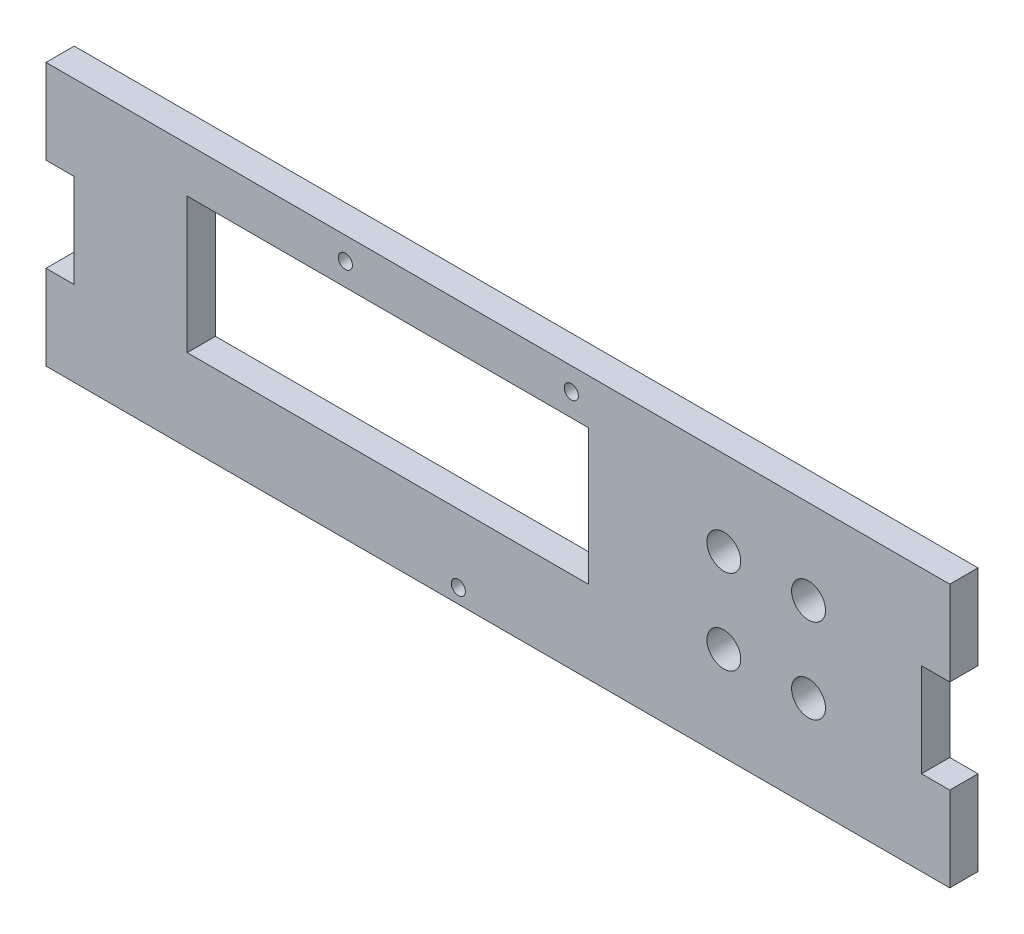
from build123d import *

# Parameters (mm, degrees)
BOSS_EXTRU_2_DEPTH      = 5
ESQUISSE1_4_W           = 71
ESQUISSE1_4_H           = 24
ENL_V_MAT_EXTRU_2_DEPTH = 7
ESQUISSE1_5_R           = 3
ESQUISSE1_5_R_2         = 1.25
ENL_V_MAT_EXTRU_3_DEPTH = 10


with BuildPart() as part:
    # Esquisse1 → Boss.-Extru.2 (new body)
    with BuildSketch(Plane.XY):
        Polygon((-79.904859092, -61.651270208), (-79.904859092, -46.651270208), (80.095140908, -46.651270208), (80.095140908, -61.651270208), (75.095140908, -61.651270208), (75.095140908, -78.221270208), (80.095140908, -78.221270208), (80.095140908, -93.221270208), (-79.904859092, -93.221270208), (-79.904859092, -78.221270208), (-74.904859092, -78.221270208), (-74.904859092, -61.651270208), align=None)
    extrude(amount=BOSS_EXTRU_2_DEPTH)

    # Esquisse1<4> → Enlèv. mat.-Extru.2 (cut)
    with BuildSketch(Plane.XY):
        with Locations((-19.404859092, -66.651270208)):
            Rectangle(ESQUISSE1_4_W, ESQUISSE1_4_H)
    extrude(amount=ENL_V_MAT_EXTRU_2_DEPTH, mode=Mode.SUBTRACT)

    # Esquisse1<5> → Enlèv. mat.-Extru.3 (cut)
    with BuildSketch(Plane.XY):
        with Locations((40.095140908, -61.651270208)):
            Circle(ESQUISSE1_5_R)
        with Locations((40.095140908, -76.651270208)):
            Circle(ESQUISSE1_5_R)
        with Locations((55.095140908, -61.651270208)):
            Circle(ESQUISSE1_5_R)
        with Locations((55.095140908, -76.651270208)):
            Circle(ESQUISSE1_5_R)
        with Locations((13.095140908, -50.651270208)):
            Circle(ESQUISSE1_5_R_2)
        with Locations((-26.904859092, -50.651270208)):
            Circle(ESQUISSE1_5_R_2)
        with Locations((-6.904859092, -90.651270208)):
            Circle(ESQUISSE1_5_R_2)
    extrude(amount=ENL_V_MAT_EXTRU_3_DEPTH, mode=Mode.SUBTRACT)


solid = part.part
